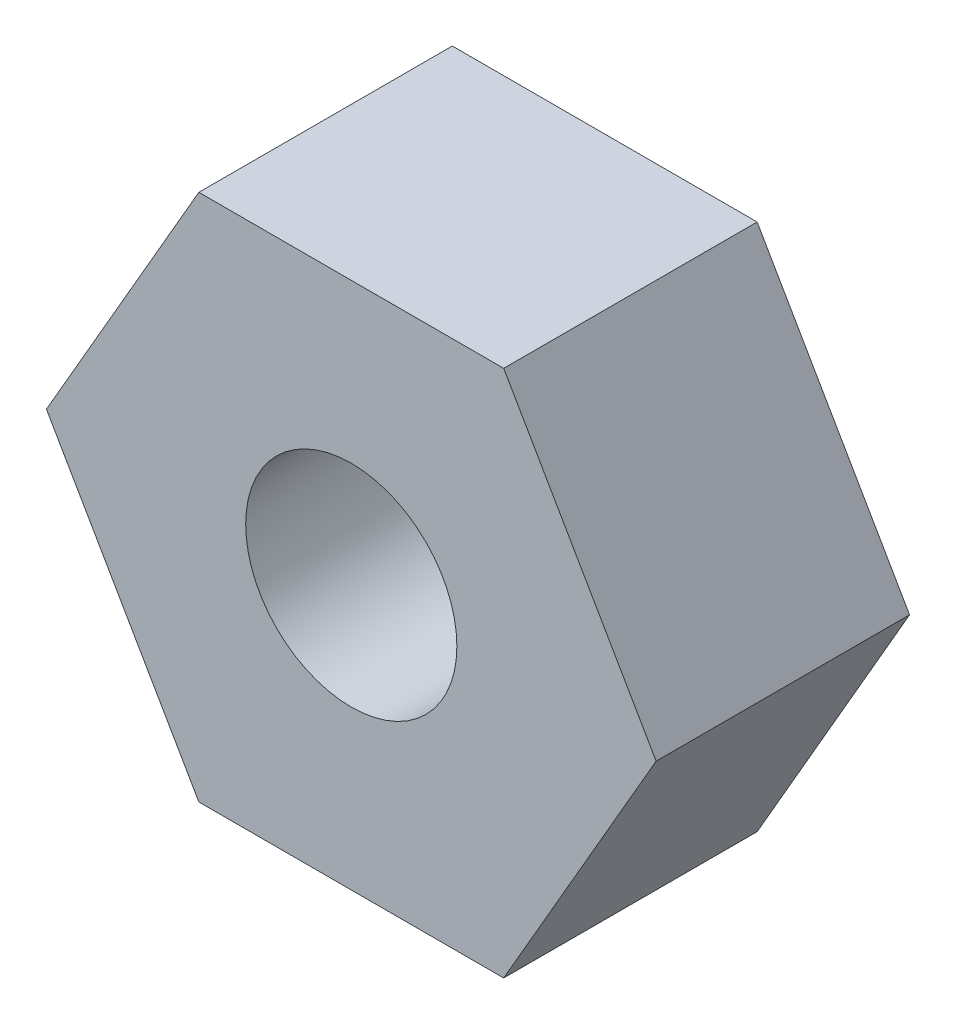
from build123d import *

# Parameters (mm, degrees)
SKETCH_1_R      = 2
EXTRUDE_1_DEPTH = 4.8


with BuildPart() as part:
    # 草图1 → 凸台-拉伸1 (new body)
    with BuildSketch(Plane.XY):
        Polygon((2.886751346, -5), (5.773502692, 0), (2.886751346, 5), (-2.886751346, 5), (-5.773502692, 0), (-2.886751346, -5), align=None)
        Circle(SKETCH_1_R, mode=Mode.SUBTRACT)
    extrude(amount=EXTRUDE_1_DEPTH)


solid = part.part
